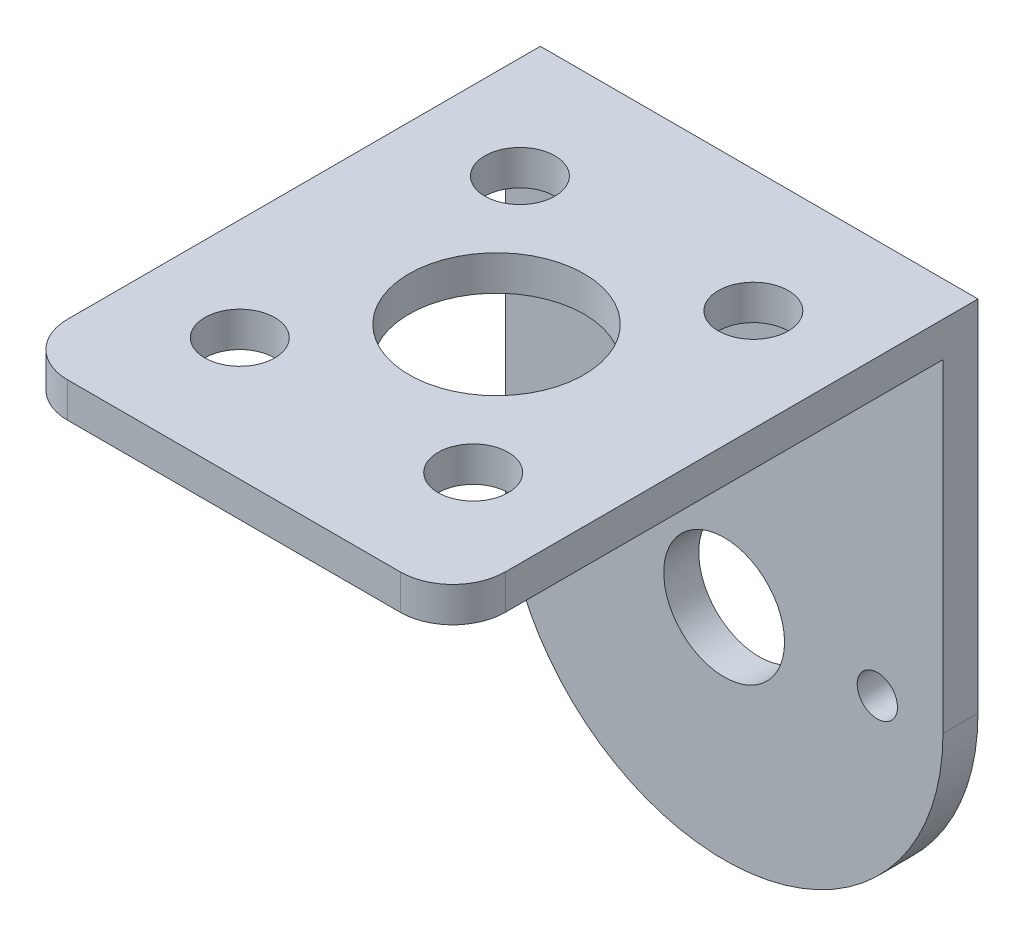
from build123d import *

# Parameters (mm, degrees)
ESBO_O1_R                = 3.45
ESBO_O1_R_2              = 1.15
RESSALTO_EXTRUS_O2_DEPTH = 2
ESBO_O2_W                = 25
ESBO_O2_H                = 2
RESSALTO_EXTRUS_O3_DEPTH = 28
ESBO_O3_R                = 5
ESBO_O3_R_2              = 2
CORTE_EXTRUS_O1_DEPTH    = 2
FILETE1_R                = 3
FILETE2_R                = 3


with BuildPart() as part:
    # Esboço1 → Ressalto-extrusão2 (new body)
    with BuildSketch(Plane.XY):
        with BuildLine():
            Line((12.456898993, -4), (12.456898993, 16.5))
            Line((12.456898993, 16.5), (-12.543101007, 16.5))
            Line((-12.543101007, 16.5), (-12.543101007, -4))
            ThreePointArc((-12.543101007, -4), (-0.043101007, -16.5), (12.456898993, -4))
        make_face()
        with Locations((-0.043101007, -4)):
            Circle(ESBO_O1_R, mode=Mode.SUBTRACT)
        with Locations((8.706898993, -4)):
            Circle(ESBO_O1_R_2, mode=Mode.SUBTRACT)
        with Locations((-8.793101007, -4)):
            Circle(ESBO_O1_R_2, mode=Mode.SUBTRACT)
    extrude(amount=RESSALTO_EXTRUS_O2_DEPTH)

    # Esboço2 → Ressalto-extrusão3 (add)
    with BuildSketch(Plane.XY.offset(2)):
        with Locations((-0.043101007, 15.5)):
            Rectangle(ESBO_O2_W, ESBO_O2_H)
    extrude(amount=RESSALTO_EXTRUS_O3_DEPTH)

    # Esboço3 → Corte-extrusão1 (cut)
    with BuildSketch(Plane.XZ.offset(-14.5)):
        with Locations(Location((-0.043101007, 15, 0), (0, 0, 270))):
            Circle(ESBO_O3_R)
        with Locations(Location((-6.709767674, 7, 0), (0, 0, 270))):
            Circle(ESBO_O3_R_2)
        with Locations(Location((6.623565659, 7, 0), (0, 0, 90))):
            Circle(ESBO_O3_R_2)
        with Locations(Location((6.623565659, 23, 0), (0, 0, 270))):
            Circle(ESBO_O3_R_2)
        with Locations(Location((-6.709767674, 23, 0), (0, 0, 90))):
            Circle(ESBO_O3_R_2)
    extrude(amount=-CORTE_EXTRUS_O1_DEPTH, mode=Mode.SUBTRACT)

    # Filete1
    filete1_edges = [part.edges().sort_by_distance(p)[0] for p in [
        (12.456898993, 15.5, 30),
    ]]
    fillet(filete1_edges, radius=FILETE1_R)

    # Filete2
    filete2_edges = [part.edges().sort_by_distance(p)[0] for p in [
        (-12.543101007, 15.5, 30),
    ]]
    fillet(filete2_edges, radius=FILETE2_R)


solid = part.part
